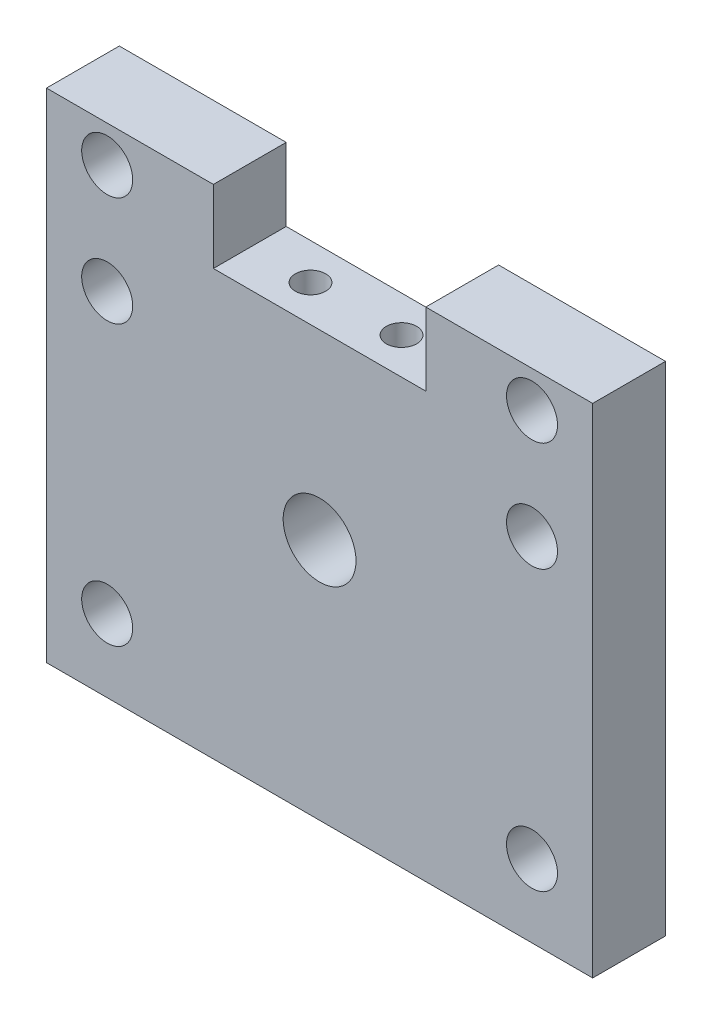
from build123d import *

# Parameters (mm, degrees)
SKETCH1_W                  = 90
SKETCH1_H                  = 82
BOSS_EXTRUDE1_DEPTH        = 6
M8_CLEARANCE_HOLE1_D       = 8.4
CUT_EXTRUDE1_DEPTH         = 94.728330829
CUT_EXTRUDE1_DEPTH_BACK    = 12
SKETCH6_W                  = 35
SKETCH6_H                  = 12
F_12_0_12_DIAMETER_HOLE1_D = 12
M6_TAPPED_HOLE1_D          = 5
M6_TAPPED_HOLE1_DEPTH      = 15.497848452
M6_TAPPED_HOLE1_TIP        = 1.502151548


with BuildPart() as part:
    # Sketch1 → Boss-Extrude1 (new, symmetric)
    with BuildSketch(Plane.XY):
        Rectangle(SKETCH1_W, SKETCH1_H)
    extrude(amount=BOSS_EXTRUDE1_DEPTH, both=True)

    # M8 Clearance Hole1 (through all)
    with Locations(Plane.XY.offset(6)):
        with Locations((-35, 17), (35, 17), (35, -29), (-35, -29), (-35, 35), (35, 35)):
            Hole(M8_CLEARANCE_HOLE1_D / 2)

    # Sketch6 → Cut-Extrude1 (cut, two sides: drawn at the far end of the back side and taken through both)
    with BuildSketch(Plane(origin=(0, 41, 0), x_dir=(1, 0, 0), z_dir=(0, 1, 0)).offset(-CUT_EXTRUDE1_DEPTH_BACK)):
        Rectangle(SKETCH6_W, SKETCH6_H)
    extrude(amount=CUT_EXTRUDE1_DEPTH + CUT_EXTRUDE1_DEPTH_BACK, mode=Mode.SUBTRACT)

    # Ø12.0 (12) Diameter Hole1 (through all)
    with Locations(Plane.XY.offset(6)):
        with Locations((0, -1)):
            Hole(F_12_0_12_DIAMETER_HOLE1_D / 2)

    # M6 Tapped Hole1
    with Locations(Plane(origin=(0, 29, 0), x_dir=(1, 0, 0), z_dir=(0, 1, 0))):
        with Locations((-7.5, 0), (7.5, 0)):
            Hole(M6_TAPPED_HOLE1_D / 2, depth=M6_TAPPED_HOLE1_DEPTH)
            with Locations((0, 0, -(M6_TAPPED_HOLE1_DEPTH + M6_TAPPED_HOLE1_TIP / 2))):  # 118° drill point
                Cone(0, M6_TAPPED_HOLE1_D / 2, M6_TAPPED_HOLE1_TIP, mode=Mode.SUBTRACT)


solid = part.part
